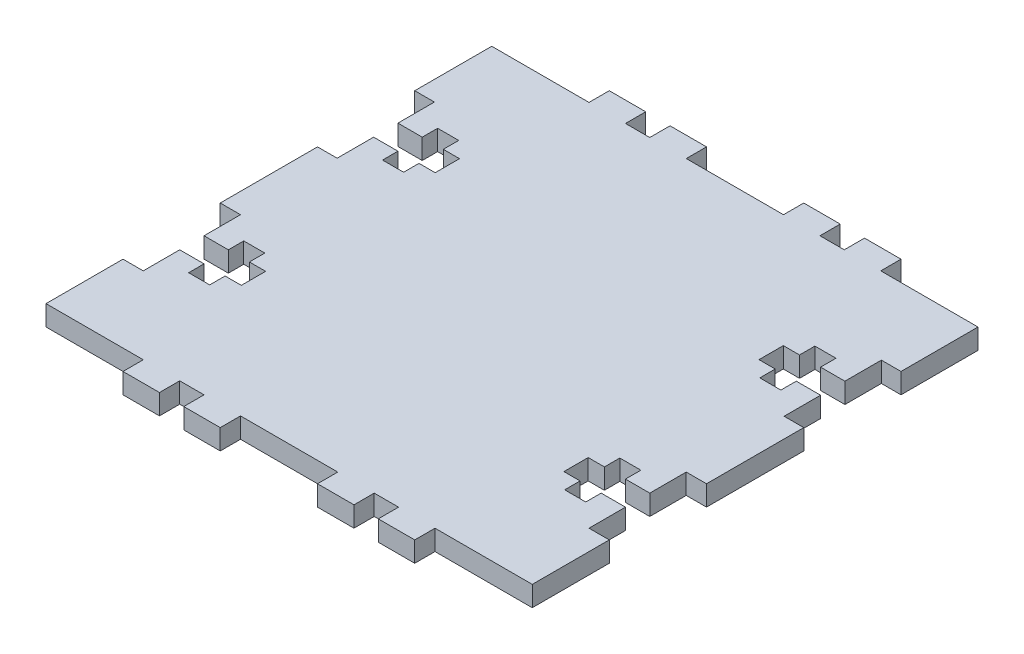
from build123d import *

# Parameters (mm, degrees)
BOSS_EXTRUDE1_DEPTH = 3.175


with BuildPart() as part:
    # Sketch1 → Boss-Extrude1 (new body)
    with BuildSketch(Plane(origin=(0, 0, 0), x_dir=(1, 0, 0), z_dir=(0, 1, 0))):
        Polygon((-27.813, -13.335), (-25.273, -13.335), (-25.273, -17.145), (-27.813, -17.145), (-27.813, -19.558), (-31.115, -19.558), (-31.115, -17.145), (-34.925, -17.145), (-34.925, -22.86), (-38.1, -22.86), (-38.1, -34.925), (-34.925, -34.925), (-22.86, -34.925), (-22.86, -38.1), (-17.145, -38.1), (-17.145, -34.925), (-13.335, -34.925), (-13.335, -38.1), (-7.62, -38.1), (-7.62, -34.925), (7.62, -34.925), (7.62, -38.1), (13.335, -38.1), (13.335, -34.925), (17.145, -34.925), (17.145, -38.1), (22.86, -38.1), (22.86, -34.925), (34.925, -34.925), (38.1, -34.925), (38.1, -22.86), (34.925, -22.86), (34.925, -17.145), (31.115, -17.145), (31.115, -19.558), (27.813, -19.558), (27.813, -17.145), (25.273, -17.145), (25.273, -13.335), (27.813, -13.335), (27.813, -10.922), (31.115, -10.922), (31.115, -13.335), (34.925, -13.335), (34.925, -7.62), (38.1, -7.62), (38.1, 7.62), (35.021495431, 7.62), (35.021495431, 13.335), (31.211495431, 13.335), (31.211495431, 10.922), (27.909495431, 10.922), (27.909495431, 13.335), (25.369495431, 13.335), (25.369495431, 17.145), (27.909495431, 17.145), (27.909495431, 19.558), (31.211495431, 19.558), (31.211495431, 17.145), (35.021495431, 17.145), (35.021495431, 22.86), (38.1, 22.86), (38.1, 34.925), (34.925, 34.925), (22.86, 34.925), (22.86, 38.1), (17.145, 38.1), (17.145, 34.925), (13.335, 34.925), (13.335, 38.1), (7.62, 38.1), (7.62, 34.925), (-7.62, 34.925), (-7.62, 38.1), (-13.335, 38.1), (-13.335, 34.925), (-17.145, 34.925), (-17.145, 38.1), (-22.86, 38.1), (-22.86, 34.925), (-34.925, 34.925), (-38.1, 34.925), (-38.1, 22.86), (-35.021495431, 22.86), (-35.021495431, 17.145), (-31.211495431, 17.145), (-31.211495431, 19.558), (-27.909495431, 19.558), (-27.909495431, 17.145), (-25.369495431, 17.145), (-25.369495431, 13.335), (-27.909495431, 13.335), (-27.909495431, 10.922), (-31.211495431, 10.922), (-31.211495431, 13.335), (-35.021495431, 13.335), (-35.021495431, 7.62), (-38.1, 7.62), (-38.1, -7.62), (-34.925, -7.62), (-34.925, -13.335), (-31.115, -13.335), (-31.115, -10.922), (-27.813, -10.922), align=None)
    extrude(amount=BOSS_EXTRUDE1_DEPTH)


solid = part.part
